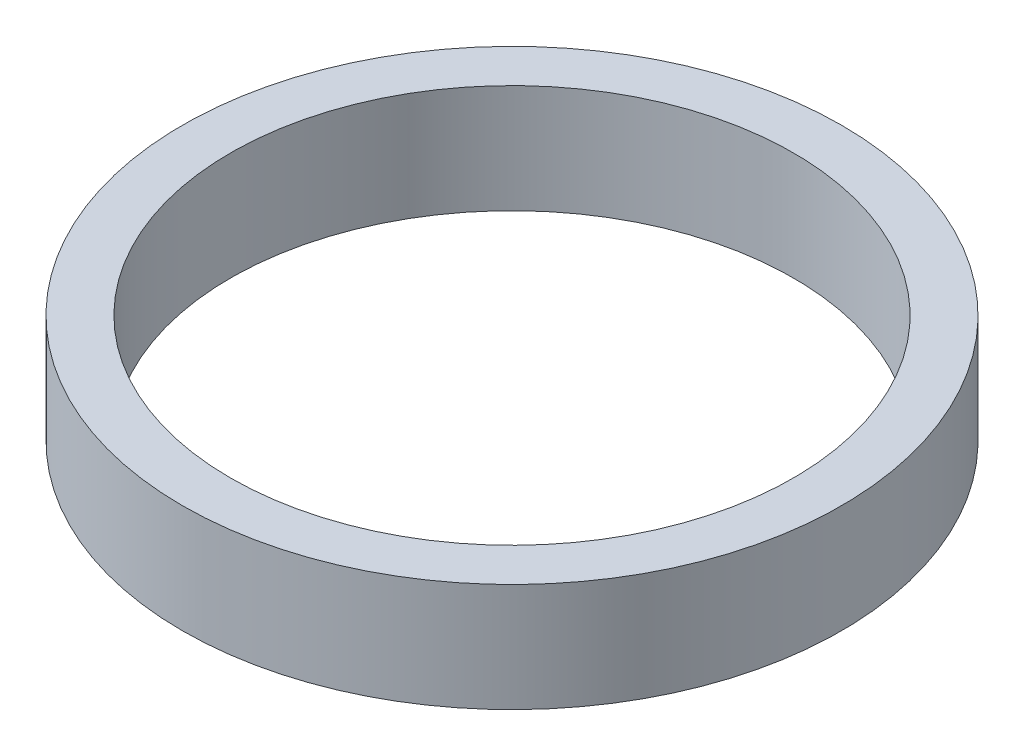
from build123d import *

# Parameters (mm, degrees)
SKETCH1_W               = 14.75
SKETCH1_H               = 4.85
CUT_EXTRUDE1_DEPTH      = 22.41605706
CUT_EXTRUDE1_DEPTH_BACK = 22.41605706
SKETCH2_R               = 12.6


with BuildPart() as part:
    # Sketch1 → Revolve1 (revolve)
    with BuildSketch(Plane.XY):
        with Locations((7.375, -2.425)):
            Rectangle(SKETCH1_W, SKETCH1_H)
    revolve(axis=Axis((0, 0, 0), (0, -1, 0)))

    # Sketch2 → Cut-Extrude1 (cut, two sides: drawn at the far end of the back side and taken through both)
    with BuildSketch(Plane(origin=(0, 0, 0), x_dir=(1, 0, 0), z_dir=(0, 1, 0)).offset(-CUT_EXTRUDE1_DEPTH_BACK)):
        Circle(SKETCH2_R)
    extrude(amount=CUT_EXTRUDE1_DEPTH + CUT_EXTRUDE1_DEPTH_BACK, mode=Mode.SUBTRACT)


solid = part.part
